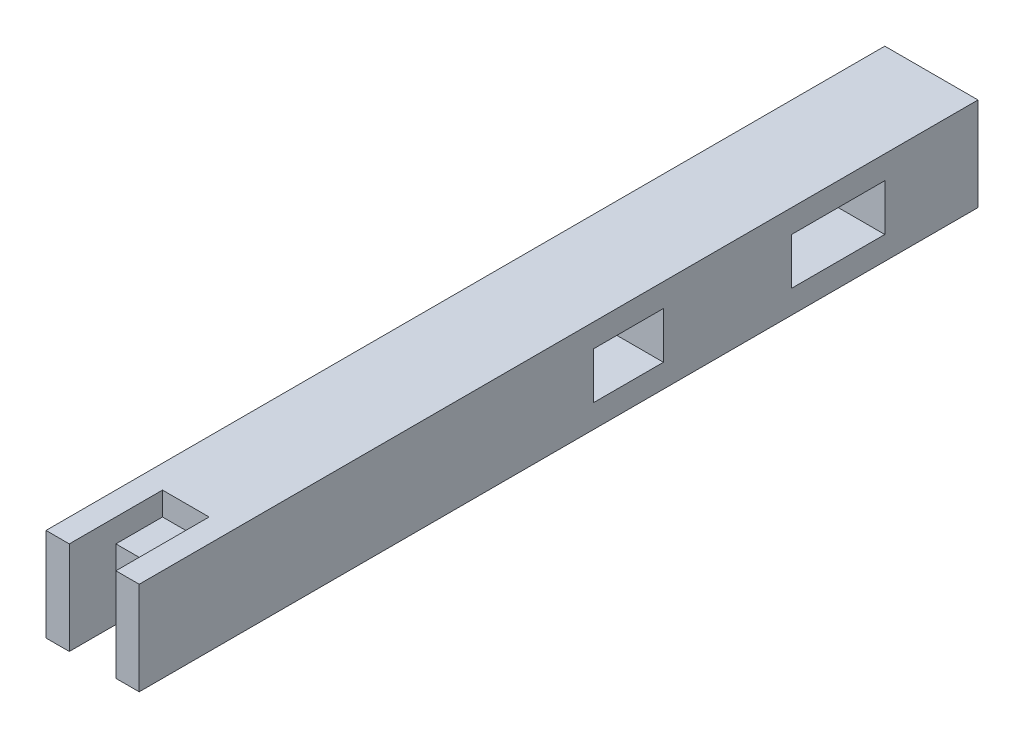
from build123d import *

# Parameters (mm, degrees)
SKETCH1_W               = 101.6
SKETCH1_H               = 101.6
BOSS_EXTRUDE1_DEPTH     = 914.4
CUT_EXTRUDE1_DEPTH      = 922.428543079
CUT_EXTRUDE1_DEPTH_BACK = 922.428543079
SKETCH2_W               = 101.6
SKETCH2_H               = 50.8
SKETCH3_W               = 50.8
SKETCH3_H               = 101.6
CUT_EXTRUDE2_DEPTH      = 50.8
SKETCH4_W               = 50.8
SKETCH4_H               = 25.4
CUT_EXTRUDE3_DEPTH      = 50.8
SKETCH5_W               = 76.2
SKETCH5_H               = 50.8
CUT_EXTRUDE4_DEPTH      = 922.428543079


with BuildPart() as part:
    # Sketch1 → Boss-Extrude1 (new body)
    with BuildSketch(Plane.XY):
        Rectangle(SKETCH1_W, SKETCH1_H)
    extrude(amount=BOSS_EXTRUDE1_DEPTH)

    # Sketch2 → Cut-Extrude1 (cut, two sides: drawn at the far end of the back side and taken through both)
    with BuildSketch(Plane(origin=(50.8, 0, 0), x_dir=(0, 0, -1), z_dir=(1, 0, 0)).offset(-CUT_EXTRUDE1_DEPTH_BACK)):
        with Locations((-152.4, 0)):
            Rectangle(SKETCH2_W, SKETCH2_H)
    extrude(amount=CUT_EXTRUDE1_DEPTH + CUT_EXTRUDE1_DEPTH_BACK, mode=Mode.SUBTRACT)

    # Sketch3 → Cut-Extrude2 (cut)
    with BuildSketch(Plane.XY.offset(914.4)):
        Rectangle(SKETCH3_W, SKETCH3_H)
    extrude(amount=-CUT_EXTRUDE2_DEPTH, mode=Mode.SUBTRACT)

    # Sketch4 → Cut-Extrude3 (cut)
    with BuildSketch(Plane.XY.offset(863.6)):
        with Locations((0, 38.1)):
            Rectangle(SKETCH4_W, SKETCH4_H)
        with Locations((0, -38.1)):
            Rectangle(SKETCH4_W, SKETCH4_H)
    extrude(amount=-CUT_EXTRUDE3_DEPTH, mode=Mode.SUBTRACT)

    # Sketch5 → Cut-Extrude4 (cut, through all)
    with BuildSketch(Plane.ZY.offset(50.8)):
        with Locations((381, 0)):
            Rectangle(SKETCH5_W, SKETCH5_H)
    extrude(amount=-CUT_EXTRUDE4_DEPTH, mode=Mode.SUBTRACT)


solid = part.part
